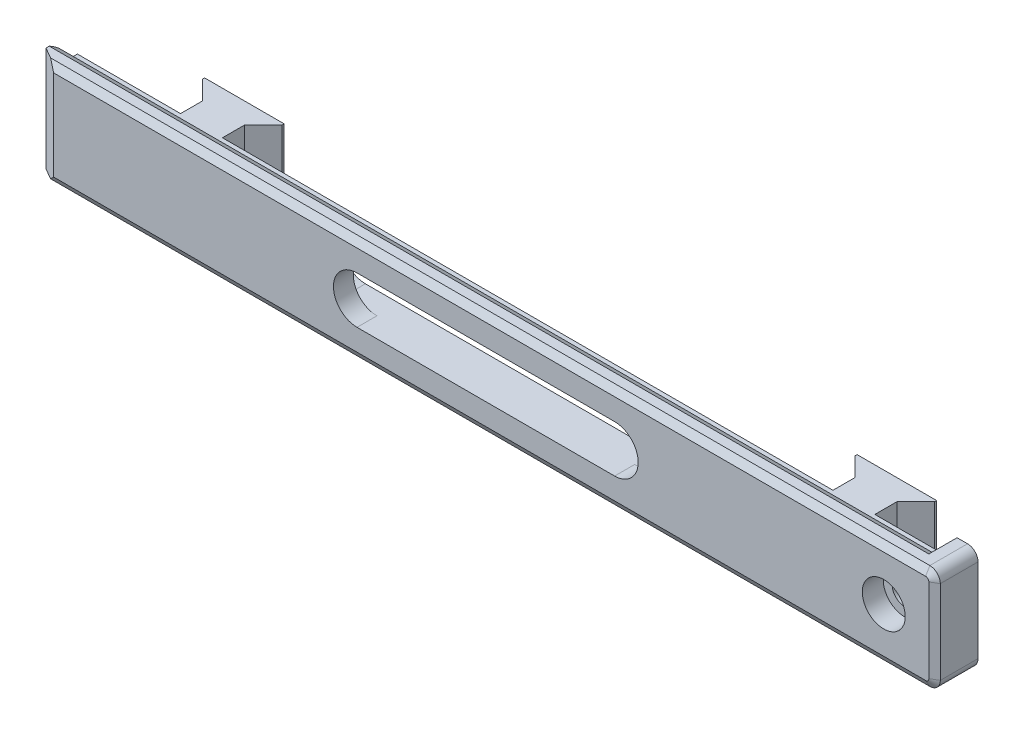
from build123d import *
from OCP.BRepFilletAPI import BRepFilletAPI_MakeChamfer

# Parameters (mm, degrees)
EXTRUDE_1_DEPTH     = 6
CUT_EXTRUDE_1_DEPTH = 2.1
CUT_EXTRUDE_2_DEPTH = 4
SKETCH_3_W          = 86
SKETCH_3_H          = 2
EXTRUDE_2_DEPTH     = 2
SKETCH_4_W          = 2
SKETCH_4_H          = 10
EXTRUDE_3_DEPTH     = 4
FILLET_1_R          = 1
CHAMFER_1_SIZE      = 1
CHAMFER_1_SIZE2     = 1.732050808
CHAMFER_2_SIZE      = 0.4
CHAMFER_2_SIZE2     = 0.692820323
SKETCH_5_R          = 1.2
CUT_EXTRUDE_3_DEPTH = 45.481569217
SKETCH_5_3_R        = 2.05
CUT_EXTRUDE_4_DEPTH = 2
CHAMFER_3_SIZE      = 0.2
CHAMFER_3_SIZE2     = 0.346410162


with BuildPart() as part:
    # 草图1 → 凸台-拉伸1 (new body)
    with BuildSketch(Plane(origin=(0, 0, 0), x_dir=(1, 0, 0), z_dir=(0, 1, 0))):
        Polygon((-43, 2), (-33.15, 2), (-33.15, 4.1), (-34.95, 5.9), (-34.95, 6.1), (-27.35, 6.1), (-27.35, 5.9), (-29.15, 4.1), (-29.15, 2), (29.15, 2), (29.15, 4.1), (27.35, 5.9), (27.35, 6.1), (34.95, 6.1), (34.95, 5.9), (33.15, 4.1), (33.15, 2), (43, 2), (43, -2), (-43, -2), align=None)
    extrude(amount=EXTRUDE_1_DEPTH)

    # 草图2 → 切除-拉伸1 (cut)
    with BuildSketch(Plane(origin=(0, 0, -2), x_dir=(-1, 0, 0), z_dir=(0, 0, -1))):
        with BuildLine():
            Line((-15.5, 5.25), (15.5, 5.25))
            ThreePointArc((15.5, 5.25), (17.75, 3), (15.5, 0.75))
            Line((15.5, 0.75), (-15.5, 0.75))
            ThreePointArc((-15.5, 0.75), (-17.75, 3), (-15.5, 5.25))
        make_face()
    extrude(amount=-CUT_EXTRUDE_1_DEPTH, mode=Mode.SUBTRACT)

    # 草图2<3> → 切除-拉伸2 (cut)
    with BuildSketch(Plane(origin=(0, 0, -2), x_dir=(-1, 0, 0), z_dir=(0, 0, -1))):
        with BuildLine():
            Line((-12.3, 5.25), (12.3, 5.25))
            ThreePointArc((12.3, 5.25), (14.55, 3), (12.3, 0.75))
            Line((12.3, 0.75), (-12.3, 0.75))
            ThreePointArc((-12.3, 0.75), (-14.55, 3), (-12.3, 5.25))
        make_face()
    extrude(amount=-CUT_EXTRUDE_2_DEPTH, mode=Mode.SUBTRACT)

    # 草图3 → 凸台-拉伸2 (add)
    with BuildSketch(Plane.XY.offset(2)):
        with Locations((0, 7)):
            Rectangle(SKETCH_3_W, SKETCH_3_H)
        with Locations((0, -1)):
            Rectangle(SKETCH_3_W, SKETCH_3_H)
    extrude(amount=-EXTRUDE_2_DEPTH)

    # 草图4 → 凸台-拉伸3 (add)
    with BuildSketch(Plane.XY.offset(2)):
        with Locations((42, 3)):
            Rectangle(SKETCH_4_W, SKETCH_4_H)
    extrude(amount=-EXTRUDE_3_DEPTH)

    # 圆角1
    fillet_1_edges = [part.edges().sort_by_distance(p)[0] for p in [
        (43, -2, 0),
        (43, 8, 0),
    ]]
    fillet(fillet_1_edges, radius=FILLET_1_R)

    # 倒角1
    chamfer_1_edges = [part.edges().sort_by_distance(p)[0] for p in [
        (-43, 3, 2),
    ]]
    chamfer_1_side = [part.faces().sort_by_distance(p)[0] for p in [
        (-43, 3, 0.25),
    ]]
    chamfer(chamfer_1_edges, length=CHAMFER_1_SIZE, length2=CHAMFER_1_SIZE2, reference=chamfer_1_side[0])

    # 倒角2: one chamfer whose edges measure the first distance from different faces: ONE call of the kernel's chamfer builder (chamfer() names one face for all edges)
    chamfer_2_edges_1 = [part.edges().sort_by_distance(p)[0] for p in [
        (-1, -2, 0),
    ]]
    chamfer_2_side_1 = [part.faces().sort_by_distance(p)[0] for p in [
        (-1, -1, 0),
    ]]
    chamfer_2_edges_2 = [part.edges().sort_by_distance(p)[0] for p in [
        (-1, 8, 0),
    ]]
    chamfer_2_side_2 = [part.faces().sort_by_distance(p)[0] for p in [
        (-1, 7, 0),
    ]]
    chamfer_2_edges_3 = [part.edges().sort_by_distance(p)[0] for p in [
        (43, 3, 2),
    ]]
    chamfer_2_side_3 = [part.faces().sort_by_distance(p)[0] for p in [
        (43, 3, 0),
    ]]
    chamfer_2_edges_4 = [part.edges().sort_by_distance(p)[0] for p in [
        (0.366025404, 8, 2),
    ]]
    chamfer_2_side_4 = [part.faces().sort_by_distance(p)[0] for p in [
        (0.202993546, 8, 0.973252826),
    ]]
    chamfer_2_edges_5 = [part.edges().sort_by_distance(p)[0] for p in [
        (42.707106781, 7.707106781, 2),
    ]]
    chamfer_2_side_5 = [part.faces().sort_by_distance(p)[0] for p in [
        (42.707106781, 7.707106781, 0),
    ]]
    chamfer_2_edges_6 = [part.edges().sort_by_distance(p)[0] for p in [
        (42.707106781, -1.707106781, 2),
    ]]
    chamfer_2_side_6 = [part.faces().sort_by_distance(p)[0] for p in [
        (42.707106781, -1.707106781, 0),
    ]]
    chamfer_2_edges_7 = [part.edges().sort_by_distance(p)[0] for p in [
        (0.366025404, -2, 2),
    ]]
    chamfer_2_side_7 = [part.faces().sort_by_distance(p)[0] for p in [
        (0.202993546, -2, 0.973252826),
    ]]
    chamfer_2 = BRepFilletAPI_MakeChamfer(part.part.solid().wrapped)
    for e in chamfer_2_edges_1:
        chamfer_2.Add(CHAMFER_2_SIZE, CHAMFER_2_SIZE2, e.wrapped, chamfer_2_side_1[0].wrapped)  # the first distance lies on this face
    for e in chamfer_2_edges_2:
        chamfer_2.Add(CHAMFER_2_SIZE, CHAMFER_2_SIZE2, e.wrapped, chamfer_2_side_2[0].wrapped)  # the first distance lies on this face
    for e in chamfer_2_edges_3:
        chamfer_2.Add(CHAMFER_2_SIZE, CHAMFER_2_SIZE2, e.wrapped, chamfer_2_side_3[0].wrapped)  # the first distance lies on this face
    for e in chamfer_2_edges_4:
        chamfer_2.Add(CHAMFER_2_SIZE, CHAMFER_2_SIZE2, e.wrapped, chamfer_2_side_4[0].wrapped)  # the first distance lies on this face
    for e in chamfer_2_edges_5:
        chamfer_2.Add(CHAMFER_2_SIZE, CHAMFER_2_SIZE2, e.wrapped, chamfer_2_side_5[0].wrapped)  # the first distance lies on this face
    for e in chamfer_2_edges_6:
        chamfer_2.Add(CHAMFER_2_SIZE, CHAMFER_2_SIZE2, e.wrapped, chamfer_2_side_6[0].wrapped)  # the first distance lies on this face
    for e in chamfer_2_edges_7:
        chamfer_2.Add(CHAMFER_2_SIZE, CHAMFER_2_SIZE2, e.wrapped, chamfer_2_side_7[0].wrapped)  # the first distance lies on this face
    add(Compound.cast(chamfer_2.Shape()), mode=Mode.REPLACE)

    # 草图5 → 切除-拉伸3 (cut, through all)
    with BuildSketch(Plane.XY.offset(2)):
        with Locations((38, 3)):
            Circle(SKETCH_5_R)
    extrude(amount=-CUT_EXTRUDE_3_DEPTH, mode=Mode.SUBTRACT)

    # 草图5<3> → 切除-拉伸4 (cut)
    with BuildSketch(Plane.XY.offset(2)):
        with Locations((38, 3)):
            Circle(SKETCH_5_3_R)
    extrude(amount=-CUT_EXTRUDE_4_DEPTH, mode=Mode.SUBTRACT)

    # 倒角3: one chamfer whose edges measure the first distance from different faces: ONE call of the kernel's chamfer builder (chamfer() names one face for all edges)
    chamfer_3_edges_1 = [part.edges().sort_by_distance(p)[0] for p in [
        (-43, -0.8, 0),
    ]]
    chamfer_3_side_1 = [part.faces().sort_by_distance(p)[0] for p in [
        (-1, -0.8, 0),
    ]]
    chamfer_3_edges_2 = [part.edges().sort_by_distance(p)[0] for p in [
        (-43, 6.8, 0),
    ]]
    chamfer_3_side_2 = [part.faces().sort_by_distance(p)[0] for p in [
        (-1, 6.8, 0),
    ]]
    chamfer_3 = BRepFilletAPI_MakeChamfer(part.part.solid().wrapped)
    for e in chamfer_3_edges_1:
        chamfer_3.Add(CHAMFER_3_SIZE, CHAMFER_3_SIZE2, e.wrapped, chamfer_3_side_1[0].wrapped)  # the first distance lies on this face
    for e in chamfer_3_edges_2:
        chamfer_3.Add(CHAMFER_3_SIZE, CHAMFER_3_SIZE2, e.wrapped, chamfer_3_side_2[0].wrapped)  # the first distance lies on this face
    add(Compound.cast(chamfer_3.Shape()), mode=Mode.REPLACE)


solid = part.part
